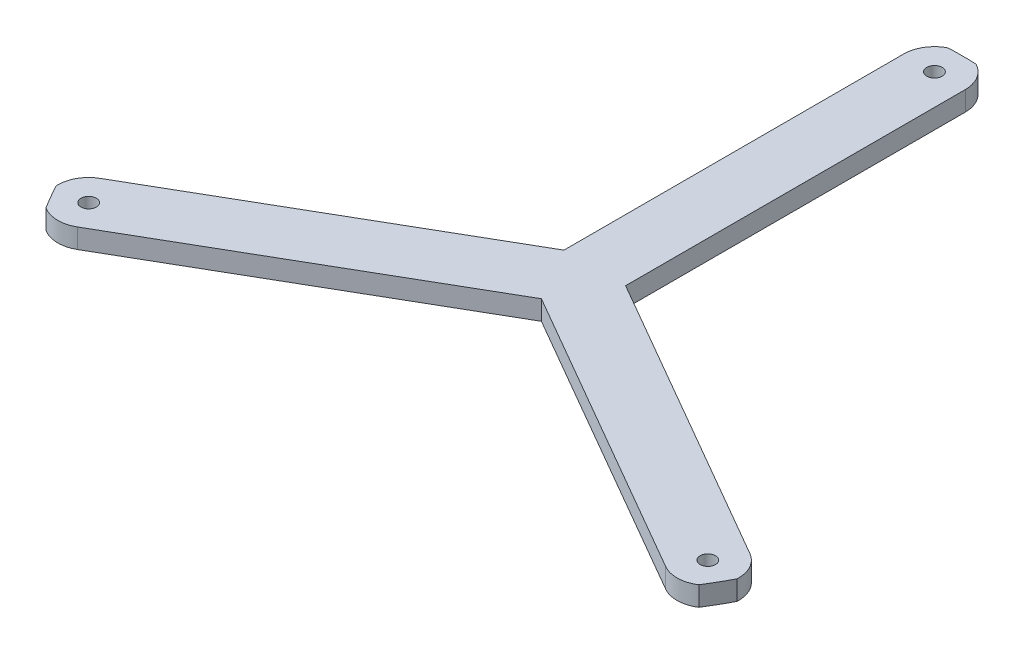
from build123d import *

# Parameters (mm, degrees)
SKETCH1_R           = 125
BOSS_EXTRUDE1_DEPTH = 6.35
SKETCH2_R           = 2.5
CUT_EXTRUDE1_DEPTH  = 177.890707783
CUT_EXTRUDE2_START  = -10
CUT_EXTRUDE2_DEPTH  = 10


with BuildPart() as part:
    # Sketch1 → Boss-Extrude1 (new body)
    with BuildSketch(Plane(origin=(0, 0, 0), x_dir=(1, 0, 0), z_dir=(0, 1, 0))):
        with Locations(Location((0, 0, 0), (0, 0, 270))):
            Circle(SKETCH1_R)
    extrude(amount=BOSS_EXTRUDE1_DEPTH)

    # Sketch2 → Cut-Extrude1 (cut, through all)
    with BuildSketch(Plane(origin=(0, 6.35, 0), x_dir=(1, 0, 0), z_dir=(0, 1, 0))):
        with Locations(Location((0, 116, 0), (0, 0, 270))):
            Circle(SKETCH2_R)
        with Locations(Location((100.458946839, -58, 0), (0, 0, 270))):
            Circle(SKETCH2_R)
        with Locations(Location((-100.458946839, -58, 0), (0, 0, 270))):
            Circle(SKETCH2_R)
    extrude(amount=-CUT_EXTRUDE1_DEPTH, mode=Mode.SUBTRACT)

    # Sketch6 → Cut-Extrude2 (cut)
    with BuildSketch(Plane(origin=(0, 6.35, 0), x_dir=(1, 0, 0), z_dir=(0, 1, 0)).offset(CUT_EXTRUDE2_START)):
        with BuildLine():
            ThreePointArc((-10, 116), (-8.52176463, 121.232545039), (-4.524094482, 124.918103448))
            ThreePointArc((-4.524094482, 124.918103448), (-108.253175473, 62.5), (-110.44429822, -58.541070973))
            ThreePointArc((-110.44429822, -58.541070973), (-109.251346085, -53.236207865), (-105.458946839, -49.339745962))
            Line((-105.458946839, -49.339745962), (-10, 5.773502692))
            Line((-10, 5.773502692), (-10, 116))
        make_face()
        with BuildLine():
            ThreePointArc((4.524094482, 124.918103448), (8.52176463, 121.232545039), (10, 116))
            Line((10, 116), (10, 5.773502692))
            Line((10, 5.773502692), (105.458946839, -49.339745962))
            ThreePointArc((105.458946839, -49.339745962), (109.251346085, -53.236207865), (110.44429822, -58.541070973))
            ThreePointArc((110.44429822, -58.541070973), (121.306506993, -30.161753285), (125, 0))
            ThreePointArc((125, 0), (89.973640057, 86.774098064), (4.524094482, 124.918103448))
        make_face()
        with BuildLine():
            Line((95.458946839, -66.660254038), (0, -11.547005384))
            Line((0, -11.547005384), (-95.458946839, -66.660254038))
            ThreePointArc((-95.458946839, -66.660254038), (-100.729581454, -67.996337174), (-105.920203738, -66.377032475))
            ThreePointArc((-105.920203738, -66.377032475), (0, -125), (105.920203738, -66.377032475))
            ThreePointArc((105.920203738, -66.377032475), (100.729581454, -67.996337174), (95.458946839, -66.660254038))
        make_face()
    extrude(amount=CUT_EXTRUDE2_DEPTH, mode=Mode.SUBTRACT)


solid = part.part
